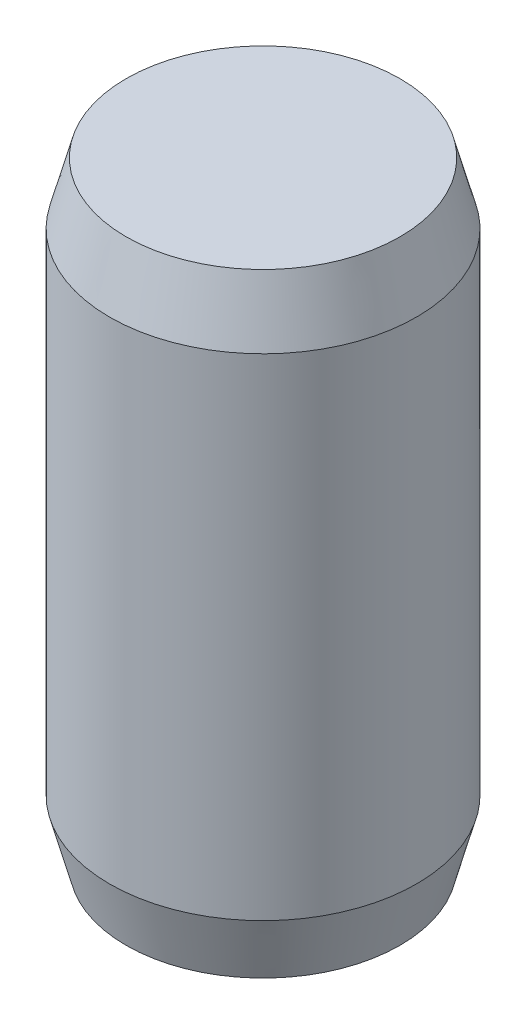
from build123d import *

# Parameters (mm, degrees)
SKETCH1_R           = 5
BOSS_EXTRUDE1_DEPTH = 20
CHAMFER1_SIZE       = 2
CHAMFER1_SIZE2      = 0.535898385
CHAMFER2_SIZE       = 2
CHAMFER2_SIZE2      = 0.535898385


with BuildPart() as part:
    # Sketch1 → Boss-Extrude1 (new body)
    with BuildSketch(Plane(origin=(0, 0, 0), x_dir=(1, 0, 0), z_dir=(0, 1, 0))):
        with Locations(Location((0, 0, 0), (0, 0, 270))):
            Circle(SKETCH1_R)
    extrude(amount=BOSS_EXTRUDE1_DEPTH)

    # Chamfer1
    chamfer1_edges = [part.edges().sort_by_distance(p)[0] for p in [
        (0, 20, -5),
    ]]
    chamfer1_side = [part.faces().sort_by_distance(p)[0] for p in [
        (0, 10, -5),
    ]]
    chamfer(chamfer1_edges, length=CHAMFER1_SIZE, length2=CHAMFER1_SIZE2, reference=chamfer1_side[0])

    # Chamfer2
    chamfer2_edges = [part.edges().sort_by_distance(p)[0] for p in [
        (0, 0, -5),
    ]]
    chamfer2_side = [part.faces().sort_by_distance(p)[0] for p in [
        (0, 9, -5),
    ]]
    chamfer(chamfer2_edges, length=CHAMFER2_SIZE, length2=CHAMFER2_SIZE2, reference=chamfer2_side[0])


solid = part.part
